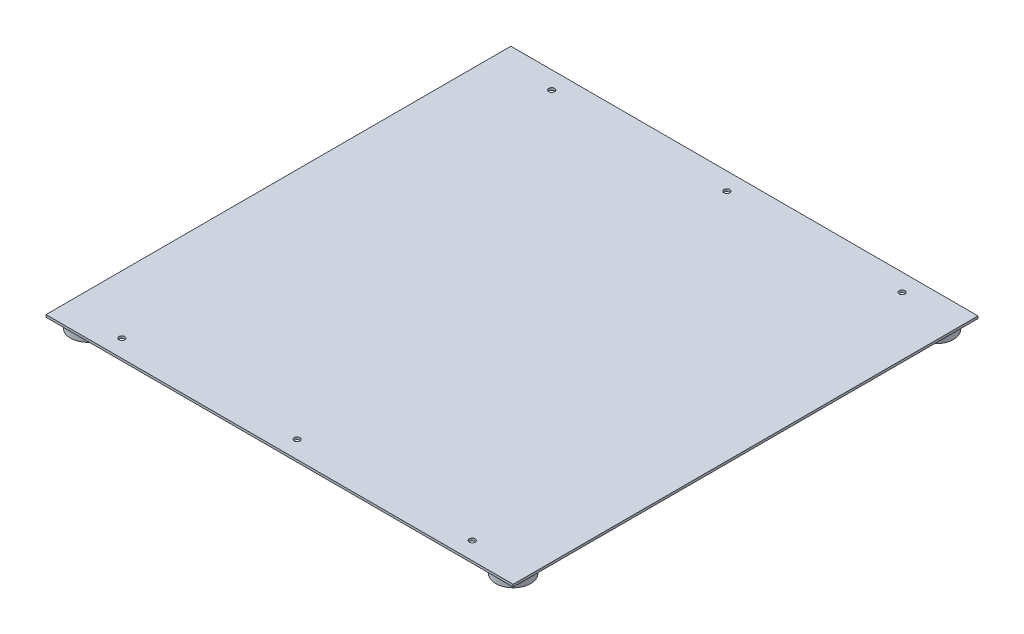
from build123d import *

# Parameters (mm, degrees)
SKETCH1_W           = 400
SKETCH1_H           = 398
SKETCH1_R           = 2.5
BOSS_EXTRUDE1_DEPTH = 2
SKETCH2_R           = 15
BOSS_EXTRUDE2_DEPTH = 8


with BuildPart() as part:
    # Sketch1 → Boss-Extrude1 (new body)
    with BuildSketch(Plane(origin=(0, 0, 0), x_dir=(1, 0, 0), z_dir=(0, 1, 0))):
        with Locations((200, 199)):
            Rectangle(SKETCH1_W, SKETCH1_H)
        with Locations(Location((50, 15, 0), (0, 0, 270))):
            Circle(SKETCH1_R, mode=Mode.SUBTRACT)
        with Locations(Location((200, 15, 0), (0, 0, 270))):
            Circle(SKETCH1_R, mode=Mode.SUBTRACT)
        with Locations(Location((350, 15, 0), (0, 0, 270))):
            Circle(SKETCH1_R, mode=Mode.SUBTRACT)
        with Locations(Location((350, 383, 0), (0, 0, 90))):
            Circle(SKETCH1_R, mode=Mode.SUBTRACT)
        with Locations(Location((200, 383, 0), (0, 0, 90))):
            Circle(SKETCH1_R, mode=Mode.SUBTRACT)
        with Locations(Location((50, 383, 0), (0, 0, 90))):
            Circle(SKETCH1_R, mode=Mode.SUBTRACT)
    extrude(amount=BOSS_EXTRUDE1_DEPTH)

    # Sketch2 → Boss-Extrude2 (add)
    with BuildSketch(Plane.XZ):
        with Locations(Location((18, -18, 0), (0, 0, 270))):
            Circle(SKETCH2_R)
        with Locations(Location((382, -18, 0), (0, 0, 90))):
            Circle(SKETCH2_R)
        with Locations(Location((382, -380, 0), (0, 0, 270))):
            Circle(SKETCH2_R)
        with Locations(Location((18, -380, 0), (0, 0, 90))):
            Circle(SKETCH2_R)
    extrude(amount=BOSS_EXTRUDE2_DEPTH)


solid = part.part
